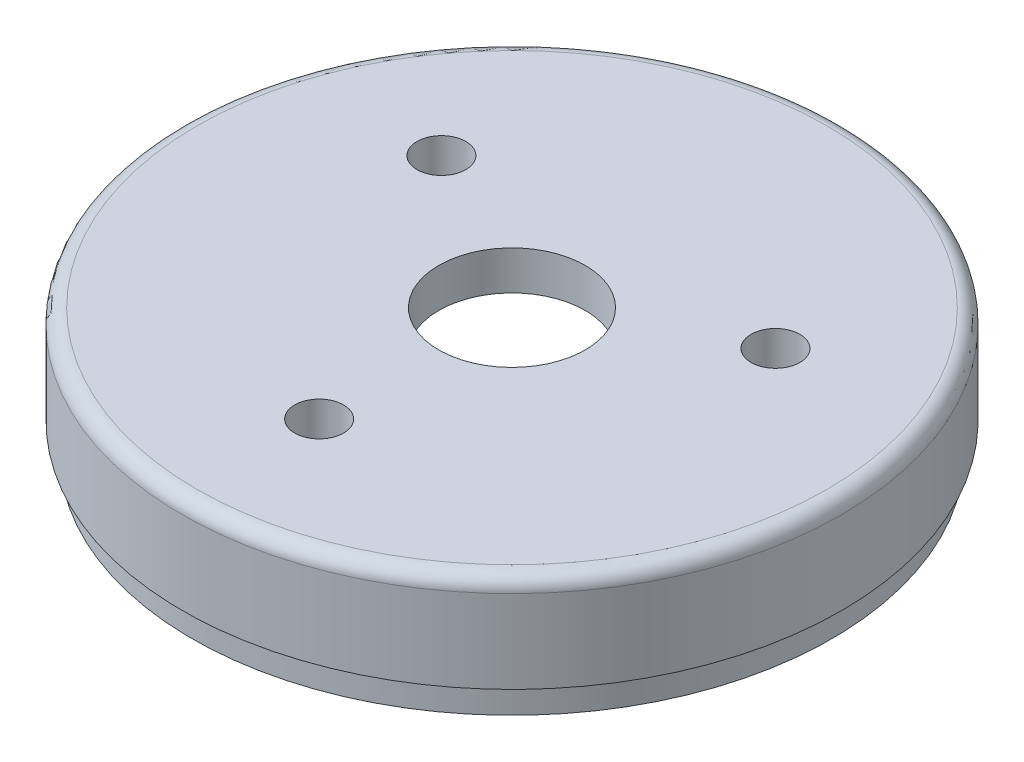
from build123d import *

# Parameters (mm, degrees)
SKETCH2_R          = 2.5
SKETCH2_R_2        = 7.5
CUT_EXTRUDE1_DEPTH = 50.468424272
FILLET1_R          = 1.5


with BuildPart() as part:
    # Sketch1 → Revolve1 (revolve)
    with BuildSketch(Plane.XY):
        Polygon((31.75, -3), (32.75, -3), (32.75, 0), (33.75, 0), (33.75, 10), (0, 10), (0, 6), (31.75, 6), align=None)
    revolve(axis=Axis((0, 10, 0), (0, -1, 0)))

    # Sketch2 → Cut-Extrude1 (cut, through all)
    with BuildSketch(Plane(origin=(0, 10, 0), x_dir=(1, 0, 0), z_dir=(0, 1, 0))):
        with Locations((0, -19.75)):
            Circle(SKETCH2_R)
        with Locations((-17.104001725, 9.875)):
            Circle(SKETCH2_R)
        with Locations((17.104001725, 9.875)):
            Circle(SKETCH2_R)
        Circle(SKETCH2_R_2)
    extrude(amount=-CUT_EXTRUDE1_DEPTH, mode=Mode.SUBTRACT)

    # Fillet1
    fillet1_edges = [part.edges().sort_by_distance(p)[0] for p in [
        (-33.75, 10, 0),
    ]]
    fillet(fillet1_edges, radius=FILLET1_R)


solid = part.part
